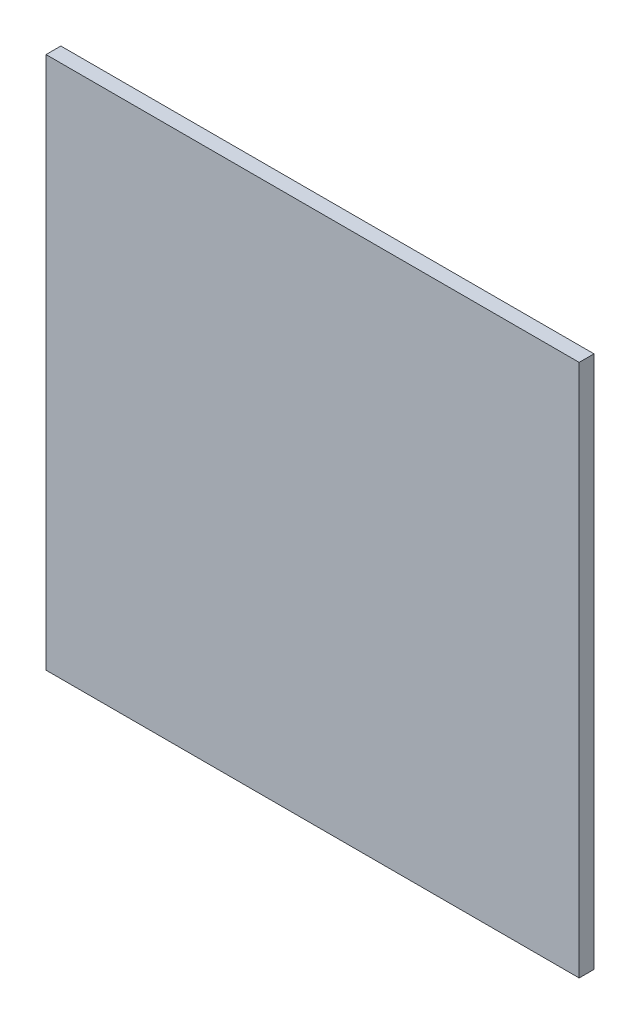
from build123d import *

# Parameters (mm, degrees)
SKETCH1_W           = 90
SKETCH1_H           = 90
BOSS_EXTRUDE1_DEPTH = 1.25


with BuildPart() as part:
    # Sketch1 → Boss-Extrude1 (new, symmetric)
    with BuildSketch(Plane.XY):
        Rectangle(SKETCH1_W, SKETCH1_H)
    extrude(amount=BOSS_EXTRUDE1_DEPTH, both=True)


solid = part.part
